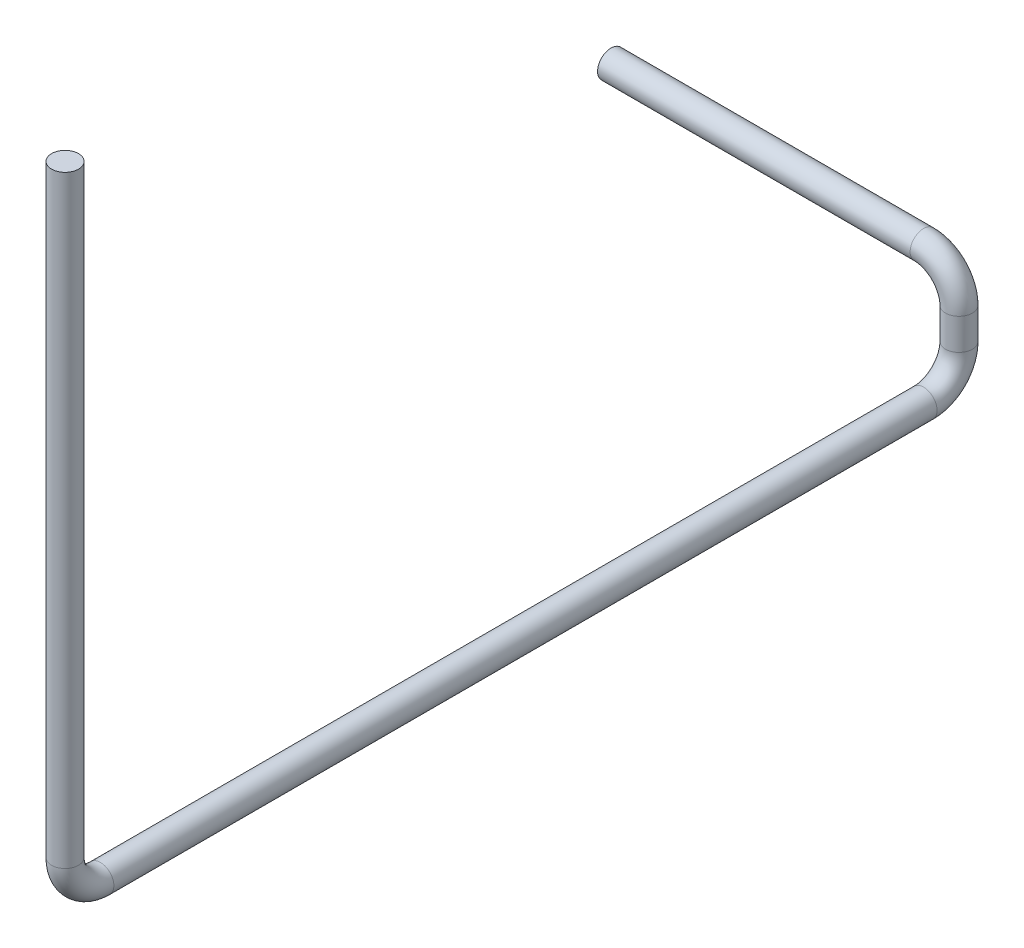
from build123d import *

# Parameters (mm, degrees)
BARRER2_PROFILE_R = 19.05


with BuildPart() as part:
    # Barrer2: sweep along a curve in space
    with BuildLine() as barrer2_path:
        Line((1158.590032243, -243.390046142, 2257.05), (1600.477366513, -243.390046142, 2257.05))
        ThreePointArc((1600.477366513, -243.390046142, 2257.05), (1635.832705573, -258.034707083, 2257.05), (1650.477366513, -293.390046142, 2257.05))
        Line((1650.477366513, -293.390046142, 2257.05), (1650.477366513, -337.599174546, 2257.05))
        ThreePointArc((1650.477366513, -337.599174546, 2257.05), (1650.477366513, -372.954513605, 2271.694660941), (1650.477366513, -387.599174546, 2307.05))
        Line((1650.477366513, -387.599174546, 2307.05), (1650.477366513, -387.599174546, 3470.805860619))
        ThreePointArc((1650.477366513, -387.599174546, 3470.805860619), (1650.477366513, -372.954513605, 3506.161199678), (1650.477366513, -337.599174546, 3520.805860619))
        Line((1650.477366513, -337.599174546, 3520.805860619), (1650.477366513, 514.750220824, 3520.805860619))
    # Barrer2 profile (on start of the path) → Barrer2 (sweep)
    with BuildSketch(Plane(origin=(1158.590032243, -243.390046142, 2257.05), x_dir=(0, 0, 1), z_dir=(1, 0, 0))):
        Circle(BARRER2_PROFILE_R)
    sweep(path=barrer2_path.line)


solid = part.part
